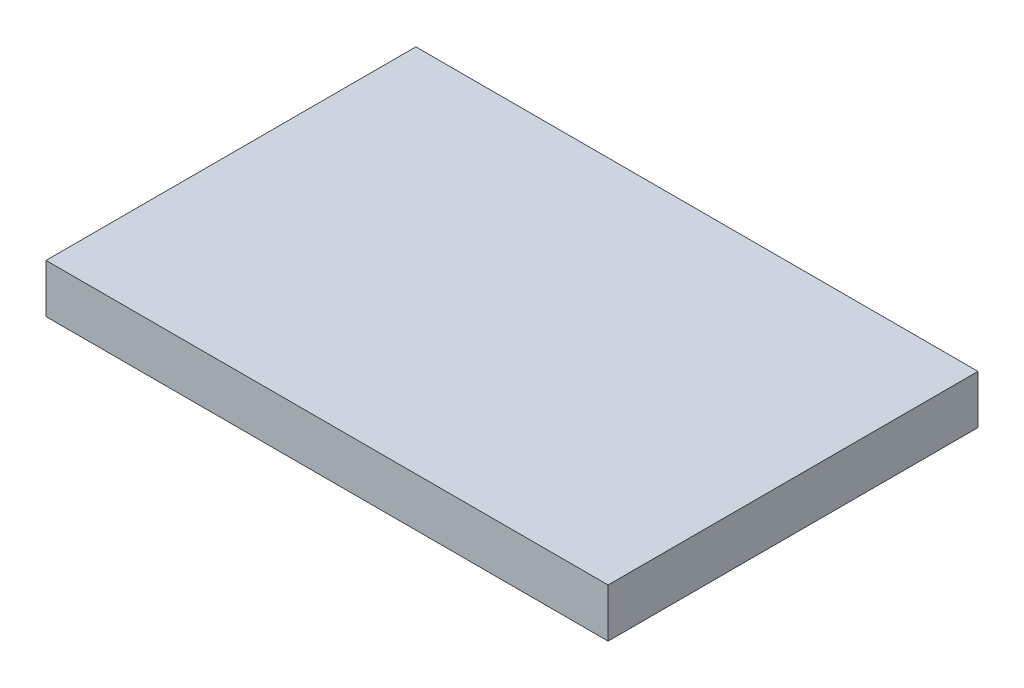
from build123d import *

# Parameters (mm, degrees)
ESQUISSE1_W        = 46.2
ESQUISSE1_H        = 30.4
BOSS_EXTRU_1_DEPTH = 4


with BuildPart() as part:
    # Esquisse1 → Boss.-Extru.1 (new body)
    with BuildSketch(Plane(origin=(0, 0, 0), x_dir=(1, 0, 0), z_dir=(0, 1, 0))):
        Rectangle(ESQUISSE1_W, ESQUISSE1_H)
    extrude(amount=BOSS_EXTRU_1_DEPTH)


solid = part.part
